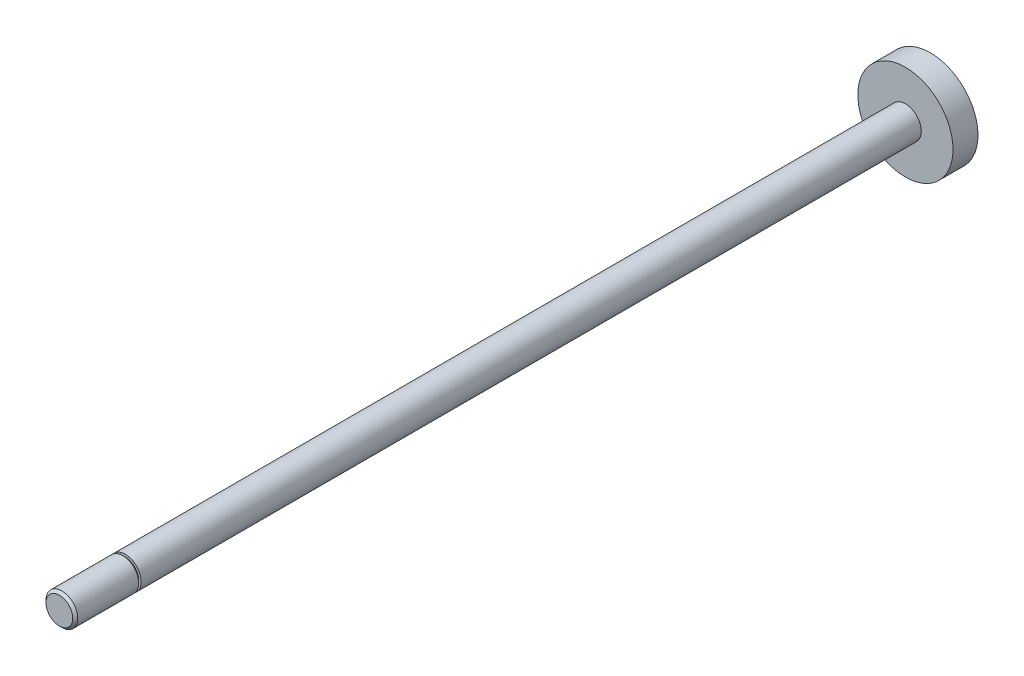
from build123d import *

# Parameters (mm, degrees)
SKETCH1_R      = 3.175
EXTRUDE1_DEPTH = 171.831
SKETCH2_R      = 9.525
PISTON_DEPTH   = 2.5


with BuildPart() as part:
    # Sketch1 → Extrude1 (new body)
    with BuildSketch(Plane.XY):
        with Locations(Location((0, 0, 0), (0, 0, 180))):
            Circle(SKETCH1_R)
    extrude(amount=EXTRUDE1_DEPTH)

    # Sketch2 → Piston (add, symmetric)
    with BuildSketch(Plane.XY):
        Circle(SKETCH2_R)
    extrude(amount=PISTON_DEPTH, both=True)

    # Sketch3 → Threads (revolve, cut)
    with BuildSketch(Plane(origin=(0, 0, 0), x_dir=(0, 0, -1), z_dir=(1, 0, 0)), mode=Mode.PRIVATE) as threads_sk:
        Polygon((-171.831, 9.525), (-158.631, 9.525), (-158.631, 2.675), (-159.131, 2.675), (-159.131, 3.175), (-171.331, 3.175), (-171.831, 2.675), align=None)
    revolve(threads_sk.sketch.rotate(Axis((0, 0, 0), (0, 0, 1)), 90), axis=Axis((0, 0, 0), (0, 0, 1)), mode=Mode.SUBTRACT)


solid = part.part
